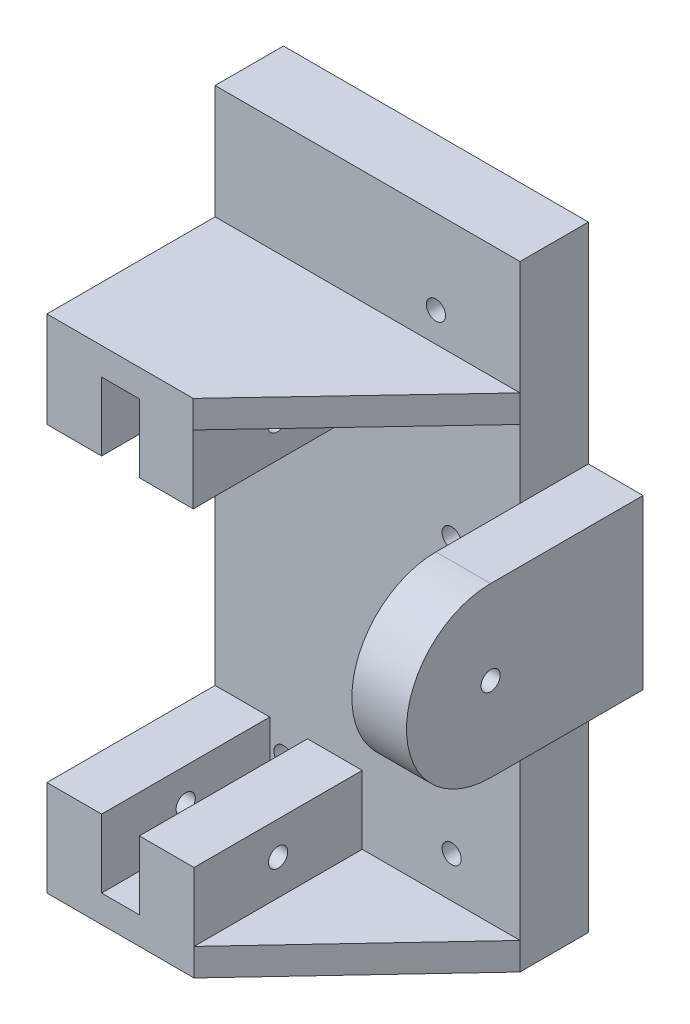
from build123d import *

# Parameters (mm, degrees)
ESQUISSE1_W             = 22.3
ESQUISSE1_H             = 43
ESQUISSE1_R             = 2.45
BOSS_EXTRU_1_DEPTH      = 5
BOSS_EXTRU_2_START      = -2.47
ESQUISSE2_R             = 2.45
ESQUISSE2_R_2           = 0.7
BOSS_EXTRU_2_DEPTH      = 2.47
ESQUISSE3_W             = 4
ESQUISSE3_H             = 5
ESQUISSE3_W_2           = 3.94
BOSS_EXTRU_3_DEPTH      = 12.3
ESQUISSE4_R             = 0.7
ENL_V_MAT_EXTRU_1_DEPTH = 52.435201954
BOSS_EXTRU_4_DEPTH      = 2
BOSS_EXTRU_5_DEPTH      = 2
ESQUISSE7_R             = 0.7
BOSS_EXTRU_6_DEPTH      = 4
ESQUISSE8_R             = 0.7
ENL_V_MAT_EXTRU_3_DEPTH = 54.118546667


with BuildPart() as part:
    # Esquisse1 → Boss.-Extru.1 (new body)
    with BuildSketch(Plane.XY):
        with Locations((-11.15, -21.5)):
            Rectangle(ESQUISSE1_W, ESQUISSE1_H)
        with Locations((-6.15, -6.15)):
            Circle(ESQUISSE1_R, mode=Mode.SUBTRACT)
    extrude(amount=BOSS_EXTRU_1_DEPTH)

    # Esquisse2 → Boss.-Extru.2 (add)
    with BuildSketch(Plane.XY.offset(5).offset(BOSS_EXTRU_2_START)):
        with Locations((-6.15, -6.15)):
            Circle(ESQUISSE2_R)
        with Locations((-6.15, -6.15)):
            Circle(ESQUISSE2_R_2, mode=Mode.SUBTRACT)
    extrude(amount=BOSS_EXTRU_2_DEPTH)

    # Esquisse3 → Boss.-Extru.3 (add)
    with BuildSketch(Plane.XY.offset(5)):
        with Locations((-20.3, -40.5)):
            Rectangle(ESQUISSE3_W, ESQUISSE3_H)
        with Locations((-13.54, -40.5)):
            Rectangle(ESQUISSE3_W, ESQUISSE3_H)
        with Locations((-20.3, -12.82)):
            Rectangle(ESQUISSE3_W, ESQUISSE3_H)
        with Locations((-13.57, -12.82)):
            Rectangle(ESQUISSE3_W_2, ESQUISSE3_H)
    extrude(amount=BOSS_EXTRU_3_DEPTH)

    # Esquisse4 → Enlèv. mat.-Extru.1 (cut, through all)
    with BuildSketch(Plane.ZY.offset(22.3)):
        with Locations((11.15, -12.82)):
            Circle(ESQUISSE4_R)
        with Locations((11.15, -40.42)):
            Circle(ESQUISSE4_R)
    extrude(amount=-ENL_V_MAT_EXTRU_1_DEPTH, mode=Mode.SUBTRACT)

    # Esquisse5 → Boss.-Extru.4 (add)
    with BuildSketch(Plane.XZ.offset(43)):
        Polygon((-22.3, 17.3), (-11.54, 17.3), (0, 5), (0, 0), (-22.3, 0), align=None)
    extrude(amount=BOSS_EXTRU_4_DEPTH)

    # Esquisse6 → Boss.-Extru.5 (add)
    with BuildSketch(Plane(origin=(0, -10.32, 0), x_dir=(1, 0, 0), z_dir=(0, 1, 0))):
        Polygon((-22.3, -5), (-22.3, -17.3), (-11.6, -17.3), (0, -5), align=None)
    extrude(amount=BOSS_EXTRU_5_DEPTH)

    # Esquisse7 → Boss.-Extru.6 (add)
    with BuildSketch(Plane(origin=(0, 0, 0), x_dir=(0, 0, -1), z_dir=(1, 0, 0))):
        with BuildLine():
            Line((-11.15, -15.32), (0, -15.32))
            Line((0, -15.32), (0, -27.62))
            Line((0, -27.62), (-11.15, -27.62))
            ThreePointArc((-11.15, -27.62), (-17.3, -21.47), (-11.15, -15.32))
        make_face()
        with Locations(Location((-11.15, -21.47, 0), (0, 0, 90))):
            Circle(ESQUISSE7_R, mode=Mode.SUBTRACT)
    extrude(amount=BOSS_EXTRU_6_DEPTH)

    # Esquisse8 → Enlèv. mat.-Extru.3 (cut, through all)
    with BuildSketch(Plane(origin=(0, 0, 0), x_dir=(-1, 0, 0), z_dir=(0, 0, -1))):
        with Locations((17.3, -40)):
            Circle(ESQUISSE8_R)
        with Locations((5, -40)):
            Circle(ESQUISSE8_R)
        with Locations((5, -20)):
            Circle(ESQUISSE8_R)
        with Locations((17.3, -20)):
            Circle(ESQUISSE8_R)
    extrude(amount=-ENL_V_MAT_EXTRU_3_DEPTH, mode=Mode.SUBTRACT)


solid = part.part
